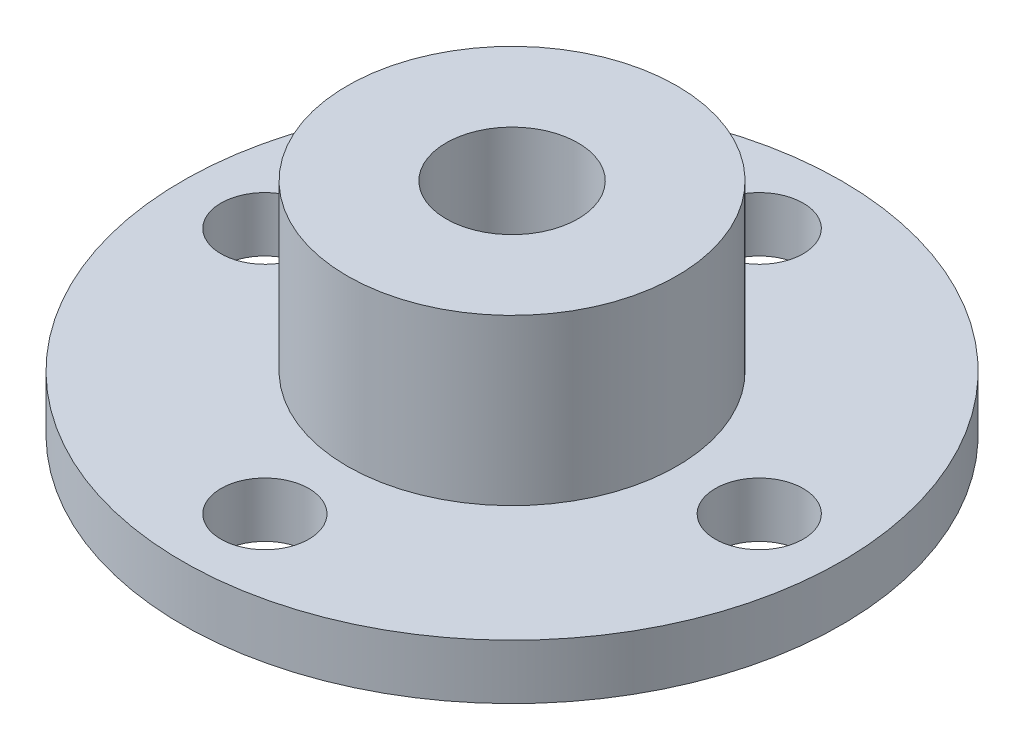
from build123d import *

# Parameters (mm, degrees)
SKETCH1_R           = 9.525
SKETCH1_R_2         = 3.81
BOSS_EXTRUDE1_DEPTH = 12.7
SKETCH2_R           = 19.05
SKETCH2_R_2         = 2.54
SKETCH2_R_3         = 9.525
BOSS_EXTRUDE2_DEPTH = 3.175


with BuildPart() as part:
    # Sketch1 → Boss-Extrude1 (new body)
    with BuildSketch(Plane(origin=(0, 0, 0), x_dir=(1, 0, 0), z_dir=(0, 1, 0))):
        with Locations(Location((0, 0, 0), (0, 0, 270))):
            Circle(SKETCH1_R)
        with Locations(Location((0, 0, 0), (0, 0, 270))):
            Circle(SKETCH1_R_2, mode=Mode.SUBTRACT)
    extrude(amount=BOSS_EXTRUDE1_DEPTH)

    # Sketch2 → Boss-Extrude2 (add)
    with BuildSketch(Plane.XZ):
        with Locations(Location((0, 0, 0), (0, 0, 270))):
            Circle(SKETCH2_R)
        with Locations(Location((0, 14.2875, 0), (0, 0, 270))):
            Circle(SKETCH2_R_2, mode=Mode.SUBTRACT)
        with Locations(Location((0, 0, 0), (0, 0, 270))):
            Circle(SKETCH2_R_3, mode=Mode.SUBTRACT)
        with Locations(Location((14.2875, 0, 0), (0, 0, 270))):
            Circle(SKETCH2_R_2, mode=Mode.SUBTRACT)
        with Locations(Location((0, -14.2875, 0), (0, 0, 270))):
            Circle(SKETCH2_R_2, mode=Mode.SUBTRACT)
        with Locations(Location((-14.2875, 0, 0), (0, 0, 270))):
            Circle(SKETCH2_R_2, mode=Mode.SUBTRACT)
    extrude(amount=-BOSS_EXTRUDE2_DEPTH)


solid = part.part
